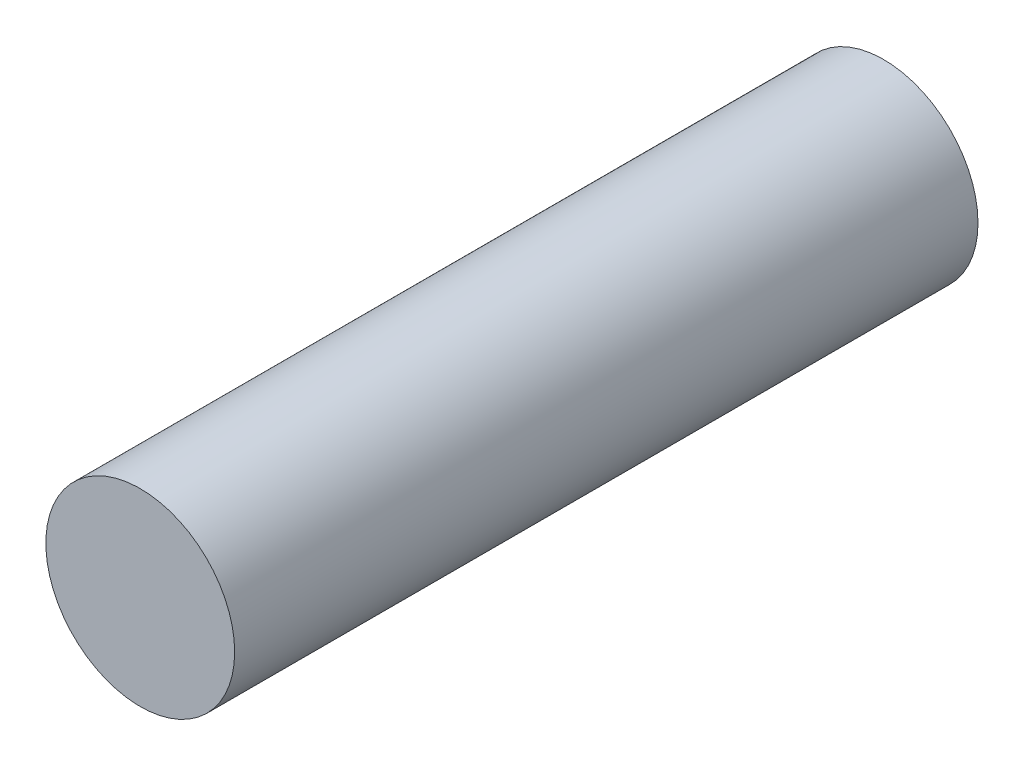
from build123d import *

# Parameters (mm, degrees)
SKETCH1_R           = 76.2
BOSS_EXTRUDE1_DEPTH = 600


with BuildPart() as part:
    # Sketch1 → Boss-Extrude1 (new body)
    with BuildSketch(Plane.XY):
        Circle(SKETCH1_R)
    extrude(amount=BOSS_EXTRUDE1_DEPTH)


solid = part.part
